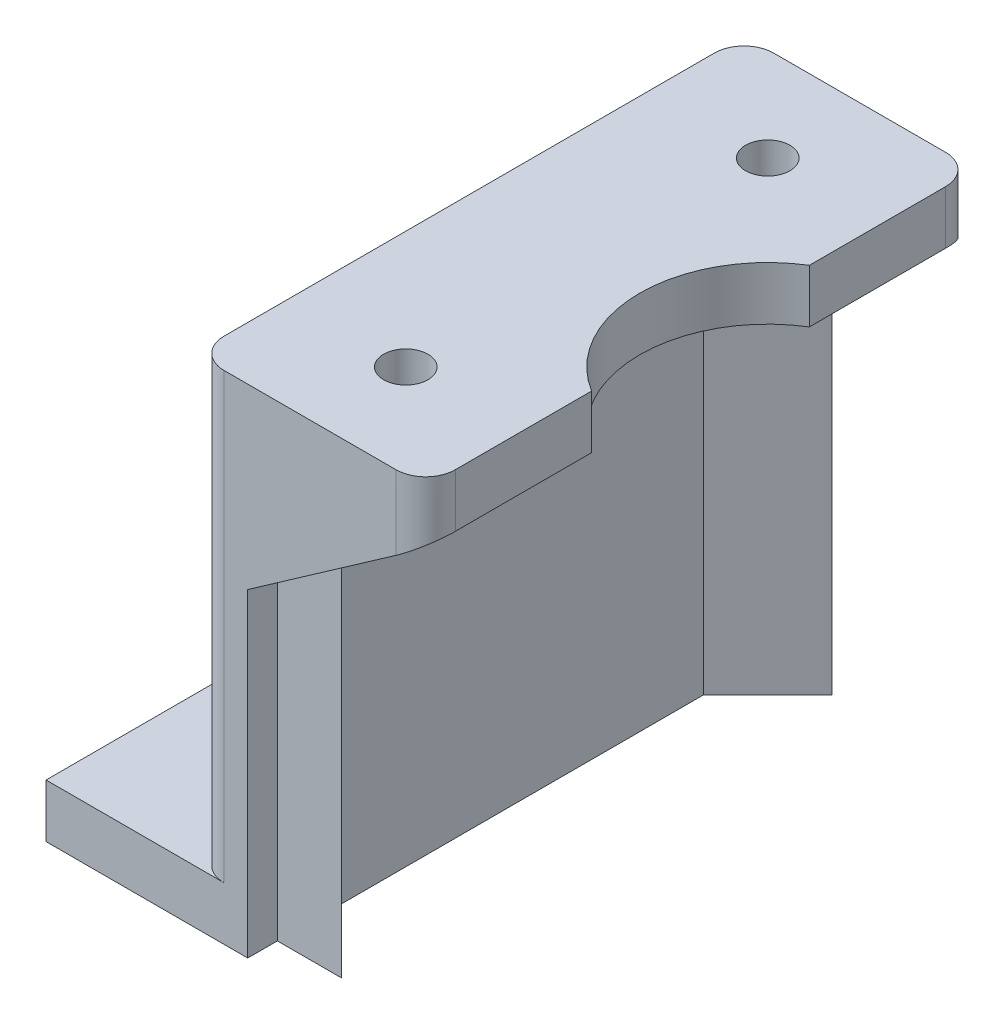
from build123d import *

# Parameters (mm, degrees)
BOSS_EXTRUDE1_DEPTH   = 47.0789
BOSS_EXTRUDE2_DEPTH   = 2.54
F_6_CLEARANCE_HOLE1_D = 3.7973
CUT_EXTRUDE1_DEPTH    = 87.844214731
FILLET1_R             = 2.54
F_6_CLEARANCE_HOLE2_D = 3.7973
BOSS_EXTRUDE3_DEPTH   = 38.00094


with BuildPart() as part:
    # Sketch1 → Boss-Extrude1 (new body)
    with BuildSketch(Plane.XY):
        Polygon((-59.2709, 1.778), (-59.2709, 6.35), (-46.5709, 6.35), (-46.5709, 44.35094), (-26.7589, 44.35094), (-26.7589, 39.77894), (-41.9989, 39.77894), (-41.9989, 6.35), (-41.9989, 1.778), (-46.5709, 1.778), align=None)
    extrude(amount=BOSS_EXTRUDE1_DEPTH)

    # Sketch2 → Boss-Extrude2 (add)
    with BuildSketch(Plane.XY.offset(47.0789)):
        Polygon((-26.7589, 39.77894), (-41.9989, 29.11094), (-41.9989, 39.77894), align=None)
    boss_extrude2 = extrude(amount=-BOSS_EXTRUDE2_DEPTH)

    # Mirror1: Boss-Extrude2 across plane
    add(boss_extrude2.mirror(Plane(origin=(0, 0, 23.53945), x_dir=(1, 0, 0), z_dir=(0, 0, -1))))

    # #6 Clearance Hole1 (through all)
    with Locations(Plane(origin=(0, 44.35094, 0), x_dir=(1, 0, 0), z_dir=(0, 1, 0))):
        with Locations((-36.4998, -8.0391), (-36.4998, -39.0398)):
            Hole(F_6_CLEARANCE_HOLE1_D / 2)

    # Sketch5 → Cut-Extrude1 (cut, through all)
    with BuildSketch(Plane(origin=(0, 44.35094, 0), x_dir=(1, 0, 0), z_dir=(0, 1, 0))):
        with BuildLine():
            Line((-26.7589, -23.53945), (-26.7589, -14.213831785))
            ThreePointArc((-26.7589, -14.213831785), (-31.96082, -23.53945), (-26.7589, -32.865068215))
            Line((-26.7589, -32.865068215), (-26.7589, -23.53945))
        make_face()
    extrude(amount=-CUT_EXTRUDE1_DEPTH, mode=Mode.SUBTRACT)

    # Fillet1
    fillet1_edges = [part.edges().sort_by_distance(p)[0] for p in [
        (-46.5709, 25.35047, 0),
        (-46.5709, 25.35047, 47.0789),
        (-26.7589, 42.06494, 47.0789),
        (-26.7589, 42.06494, 0),
    ]]
    fillet(fillet1_edges, radius=FILLET1_R)

    # #6 Clearance Hole2 (through all)
    with Locations(Plane(origin=(0, 6.35, 0), x_dir=(1, 0, 0), z_dir=(0, 1, 0))):
        with Locations((-52.9209, -10.83945), (-52.9209, -36.23945)):
            Hole(F_6_CLEARANCE_HOLE2_D / 2)

    # Sketch8 → Boss-Extrude3 (add)
    with BuildSketch(Plane.XZ.offset(-39.77894)):
        Polygon((-41.9989, 44.5389), (-41.9989, 39.0398), (-36.4998, 44.5389), align=None)
        Polygon((-41.9989, 2.54), (-36.4998, 2.54), (-41.9989, 8.0391), align=None)
    extrude(amount=BOSS_EXTRUDE3_DEPTH)


solid = part.part
